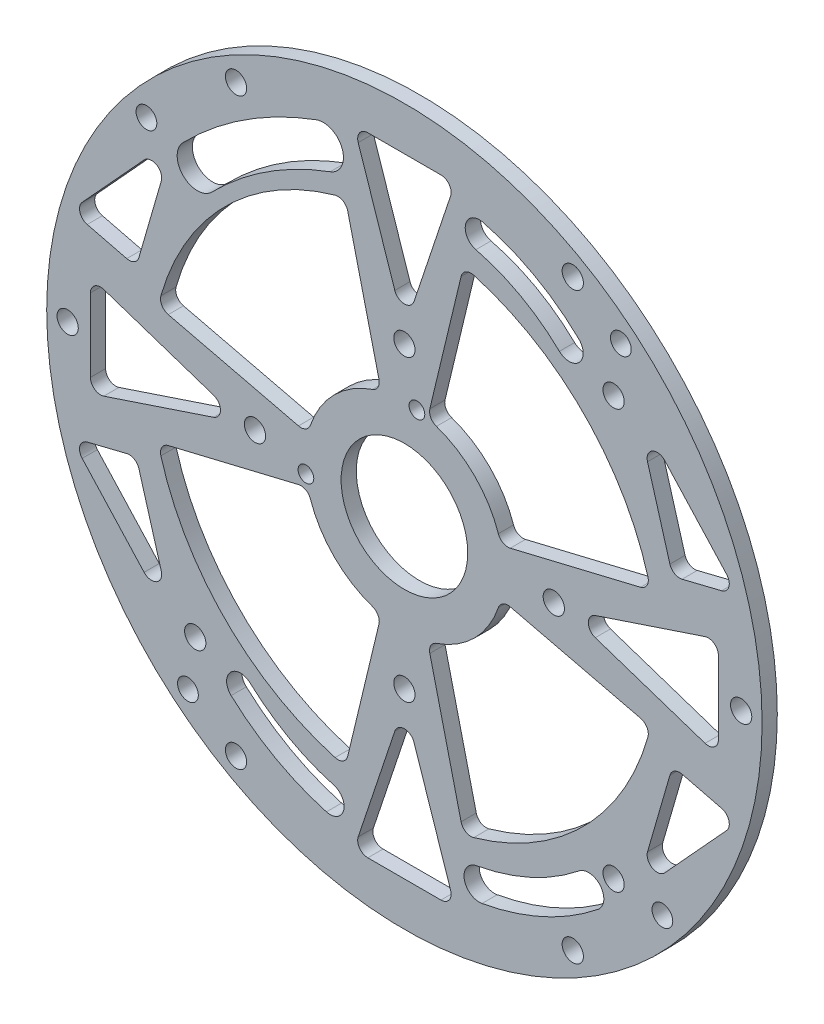
from build123d import *

# Parameters (mm, degrees)
SKETCH_1_R          = 70.64
SKETCH_1_R_2        = 2.1
SKETCH_1_R_3        = 1.55
EXTRUDE_1_DEPTH     = 3
SKETCH_2_R          = 12.5
CUT_EXTRUDE_1_DEPTH = 100.945080919
SKETCH_5_R          = 2.05
CUT_EXTRUDE_2_DEPTH = 100.945080919
CUT_EXTRUDE_3_DEPTH = 100.945080919
FILLET_1_R          = 2
CUT_EXTRUDE_4_DEPTH = 100.945080919


with BuildPart() as part:
    # 草图1 → 凸台-拉伸1 (new body)
    with BuildSketch(Plane.XY):
        Circle(SKETCH_1_R)
        with Locations((41.308177097, 41.308177097)):
            Circle(SKETCH_1_R_2, mode=Mode.SUBTRACT)
        with Locations((33.25, 57.590689352)):
            Circle(SKETCH_1_R_2, mode=Mode.SUBTRACT)
        with Locations((66.5, 0)):
            Circle(SKETCH_1_R_2, mode=Mode.SUBTRACT)
        with Locations((33.25, -57.590689352)):
            Circle(SKETCH_1_R_2, mode=Mode.SUBTRACT)
        with Locations((-33.25, -57.590689352)):
            Circle(SKETCH_1_R_2, mode=Mode.SUBTRACT)
        with Locations((-66.5, 0)):
            Circle(SKETCH_1_R_2, mode=Mode.SUBTRACT)
        with Locations((-33.25, 57.590689352)):
            Circle(SKETCH_1_R_2, mode=Mode.SUBTRACT)
        with Locations((41.308177097, -41.308177097)):
            Circle(SKETCH_1_R_2, mode=Mode.SUBTRACT)
        with Locations((-41.308177097, -41.308177097)):
            Circle(SKETCH_1_R_2, mode=Mode.SUBTRACT)
        with Locations((0, -29.5)):
            Circle(SKETCH_1_R_2, mode=Mode.SUBTRACT)
        with Locations((-29.5, 0)):
            Circle(SKETCH_1_R_2, mode=Mode.SUBTRACT)
        with Locations((0, 29.5)):
            Circle(SKETCH_1_R_2, mode=Mode.SUBTRACT)
        with Locations((29.5, 0)):
            Circle(SKETCH_1_R_2, mode=Mode.SUBTRACT)
        with Locations((2.474873734, 19.445436483)):
            Circle(SKETCH_1_R_3, mode=Mode.SUBTRACT)
        with Locations((-19.445436483, -2.474873734)):
            Circle(SKETCH_1_R_3, mode=Mode.SUBTRACT)
    extrude(amount=EXTRUDE_1_DEPTH)

    # 草图2 → 切除-拉伸1 (cut, through all)
    with BuildSketch(Plane.XY.offset(3)):
        Circle(SKETCH_2_R)
    extrude(amount=-CUT_EXTRUDE_1_DEPTH, mode=Mode.SUBTRACT)

    # 草图5 → 切除-拉伸2 (cut, through all)
    with BuildSketch(Plane.XY.offset(3)):
        with Locations((-50.941955467, 42.745376044)):
            Circle(SKETCH_5_R)
        with Locations((42.745376044, 50.941955467)):
            Circle(SKETCH_5_R)
        with Locations((50.941955467, -42.745376044)):
            Circle(SKETCH_5_R)
        with Locations((-42.745376044, -50.941955467)):
            Circle(SKETCH_5_R)
    extrude(amount=-CUT_EXTRUDE_2_DEPTH, mode=Mode.SUBTRACT)

    # 草图6 → 切除-拉伸3 (cut, through all)
    with BuildSketch(Plane.XY.offset(3)):
        with BuildLine():
            Line((-4.576065072, 19.060682791), (-11.672268193, 48.61849602))
            ThreePointArc((-11.672268193, 48.61849602), (-35.355339059, 35.355339059), (-48.61849602, 11.672268193))
            Line((-48.61849602, 11.672268193), (-19.060682791, 4.576065072))
            ThreePointArc((-19.060682791, 4.576065072), (-13.860916276, 13.860916276), (-4.576065072, 19.060682791))
        make_face()
        with BuildLine():
            Line((19.060682791, 4.576065072), (48.61849602, 11.672268193))
            ThreePointArc((48.61849602, 11.672268193), (35.355339059, 35.355339059), (11.672268193, 48.61849602))
            Line((11.672268193, 48.61849602), (4.576065072, 19.060682791))
            ThreePointArc((4.576065072, 19.060682791), (13.860916276, 13.860916276), (19.060682791, 4.576065072))
        make_face()
        with BuildLine():
            Line((4.576065072, -19.060682791), (11.672268193, -48.61849602))
            ThreePointArc((11.672268193, -48.61849602), (35.355339059, -35.355339059), (48.61849602, -11.672268193))
            Line((48.61849602, -11.672268193), (19.060682791, -4.576065072))
            ThreePointArc((19.060682791, -4.576065072), (13.860916276, -13.860916276), (4.576065072, -19.060682791))
        make_face()
        with BuildLine():
            Line((-19.060682791, -4.576065072), (-48.61849602, -11.672268193))
            ThreePointArc((-48.61849602, -11.672268193), (-35.355339059, -35.355339059), (-11.672268193, -48.61849602))
            Line((-11.672268193, -48.61849602), (-4.576065072, -19.060682791))
            ThreePointArc((-4.576065072, -19.060682791), (-13.860916276, -13.860916276), (-19.060682791, -4.576065072))
        make_face()
        Polygon((-10, 62), (10, 62), (0, 32), align=None)
        Polygon((32, 0), (62, 10), (62, -10), align=None)
        Polygon((0, -32), (10, -62), (-10, -62), align=None)
        Polygon((-32, 0), (-62, -10), (-62, 10), align=None)
        Polygon((52.962057119, -16.209483435), (65.903980805, -19.41411476), (45.635039833, -41.568110983), align=None)
        Polygon((65.903980805, 19.41411476), (45.635039833, 41.568110983), (52.962057119, 16.209483435), align=None)
        Polygon((-52.962057119, 16.209483435), (-65.903980805, 19.41411476), (-45.635039833, 41.568110983), align=None)
        Polygon((-65.903980805, -19.41411476), (-45.635039833, -41.568110983), (-52.962057119, -16.209483435), align=None)
    extrude(amount=-CUT_EXTRUDE_3_DEPTH, mode=Mode.SUBTRACT)

    # 圆角1
    fillet_1_edges = [part.edges().sort_by_distance(p)[0] for p in [
        (45.635039833, -41.568110983, 1.5),
        (52.962057119, -16.209483435, 1.5),
        (65.903980805, -19.41411476, 1.5),
        (65.903980805, 19.41411476, 1.5),
        (52.962057119, 16.209483435, 1.5),
        (45.635039833, 41.568110983, 1.5),
        (62, 10, 1.5),
        (62, -10, 1.5),
        (32, 0, 1.5),
        (10, -62, 1.5),
        (-10, -62, 1.5),
        (0, -32, 1.5),
        (-19.060682791, -4.576065072, 1.5),
        (-4.576065072, -19.060682791, 1.5),
        (-11.672268193, -48.61849602, 1.5),
        (-48.61849602, -11.672268193, 1.5),
        (4.576065072, -19.060682791, 1.5),
        (19.060682791, -4.576065072, 1.5),
        (48.61849602, -11.672268193, 1.5),
        (11.672268193, -48.61849602, 1.5),
        (19.060682791, 4.576065072, 1.5),
        (4.576065072, 19.060682791, 1.5),
        (11.672268193, 48.61849602, 1.5),
        (48.61849602, 11.672268193, 1.5),
        (-4.576065072, 19.060682791, 1.5),
        (-19.060682791, 4.576065072, 1.5),
        (-48.61849602, 11.672268193, 1.5),
        (-11.672268193, 48.61849602, 1.5),
        (-62, -10, 1.5),
        (-62, 10, 1.5),
        (-32, 0, 1.5),
        (-45.635039833, 41.568110983, 1.5),
        (-52.962057119, 16.209483435, 1.5),
        (-65.903980805, 19.41411476, 1.5),
        (-65.903980805, -19.41411476, 1.5),
        (-52.962057119, -16.209483435, 1.5),
        (-45.635039833, -41.568110983, 1.5),
        (0, 32, 1.5),
        (-10, 62, 1.5),
        (10, 62, 1.5),
    ]]
    fillet(fillet_1_edges, radius=FILLET_1_R)

    # 草图7 → 切除-拉伸4 (cut, through all)
    with BuildSketch(Plane.XY.offset(3)):
        with BuildLine():
            ThreePointArc((-17.422756273, 59.11797816), (-31.534910164, 52.05319727), (-43.737820568, 42.045550485))
            ThreePointArc((-43.737820568, 42.045550485), (-43.665129254, 36.389163301), (-38.008742071, 36.461854615))
            ThreePointArc((-38.008742071, 36.461854615), (-27.180807487, 45.341879226), (-14.658755443, 51.610628467))
            ThreePointArc((-14.658755443, 51.610628467), (-12.287081012, 56.746303729), (-17.422756273, 59.11797816))
        make_face()
        with BuildLine():
            ThreePointArc((34.460401115, 47.535925761), (25.648718973, 54.040105851), (15.460227519, 58.058157956))
            ThreePointArc((15.460227519, 58.058157956), (12.091312412, 56.039363778), (14.11010659, 52.670448672))
            ThreePointArc((14.11010659, 52.670448672), (22.957846175, 49.181151084), (30.609957309, 43.532886872))
            ThreePointArc((30.609957309, 43.532886872), (34.536698657, 43.609184414), (34.460401115, 47.535925761))
        make_face()
        with BuildLine():
            ThreePointArc((-34.220407145, -47.753045621), (-25.429192431, -54.105658673), (-15.397477434, -58.229472799))
            ThreePointArc((-15.397477434, -58.229472799), (-12.011807829, -56.321247176), (-13.920033452, -52.935577571))
            ThreePointArc((-13.920033452, -52.935577571), (-22.756252751, -49.303205044), (-30.499804191, -43.707643162))
            ThreePointArc((-30.499804191, -43.707643162), (-34.382806898, -43.870042915), (-34.220407145, -47.753045621))
        make_face()
        with BuildLine():
            ThreePointArc((15.323186317, -58.543330734), (27.442964192, -54.741609142), (38.256000225, -48.076749461))
            ThreePointArc((38.256000225, -48.076749461), (38.718203216, -43.846142313), (34.487596067, -43.383939322))
            ThreePointArc((34.487596067, -43.383939322), (24.944035587, -49.266328992), (14.247147792, -52.621719636))
            ThreePointArc((14.247147792, -52.621719636), (11.824361505, -56.120544448), (15.323186317, -58.543330734))
        make_face()
    extrude(amount=-CUT_EXTRUDE_4_DEPTH, mode=Mode.SUBTRACT)


solid = part.part
